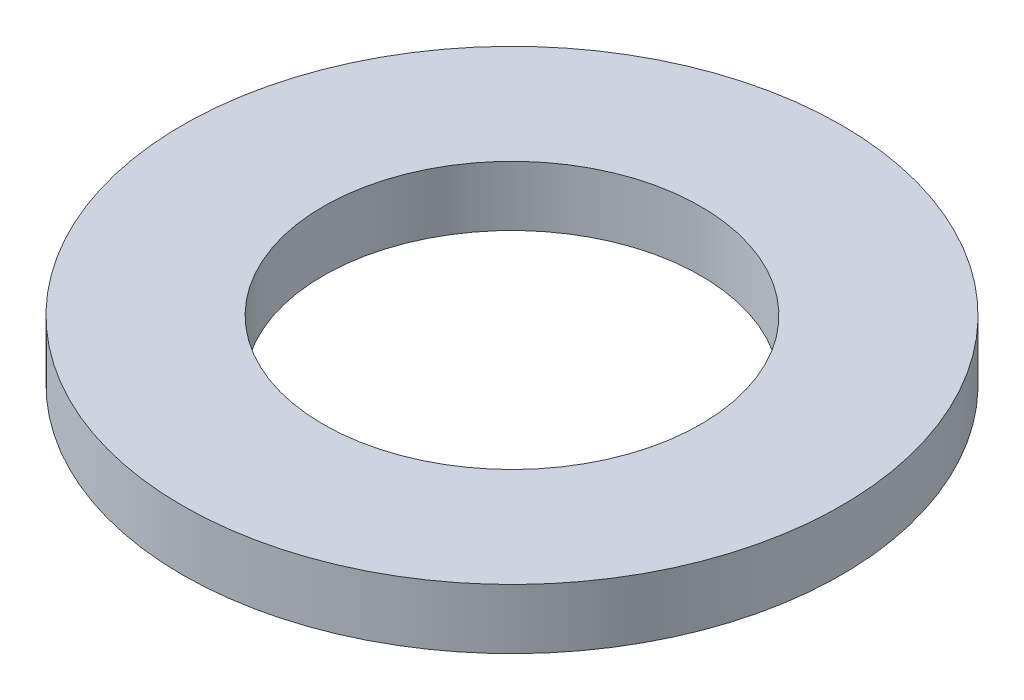
from build123d import *

# Parameters (mm, degrees)
SKETCH1_R           = 5.5
SKETCH1_R_2         = 3.15
BOSS_EXTRUDE1_DEPTH = 1


with BuildPart() as part:
    # Sketch1 → Boss-Extrude1 (new body)
    with BuildSketch(Plane(origin=(0, 0, 0), x_dir=(1, 0, 0), z_dir=(0, 1, 0))):
        with Locations(Location((0, 0, 0), (0, 0, 270))):
            Circle(SKETCH1_R)
        with Locations(Location((0, 0, 0), (0, 0, 270))):
            Circle(SKETCH1_R_2, mode=Mode.SUBTRACT)
    extrude(amount=BOSS_EXTRUDE1_DEPTH)


solid = part.part
